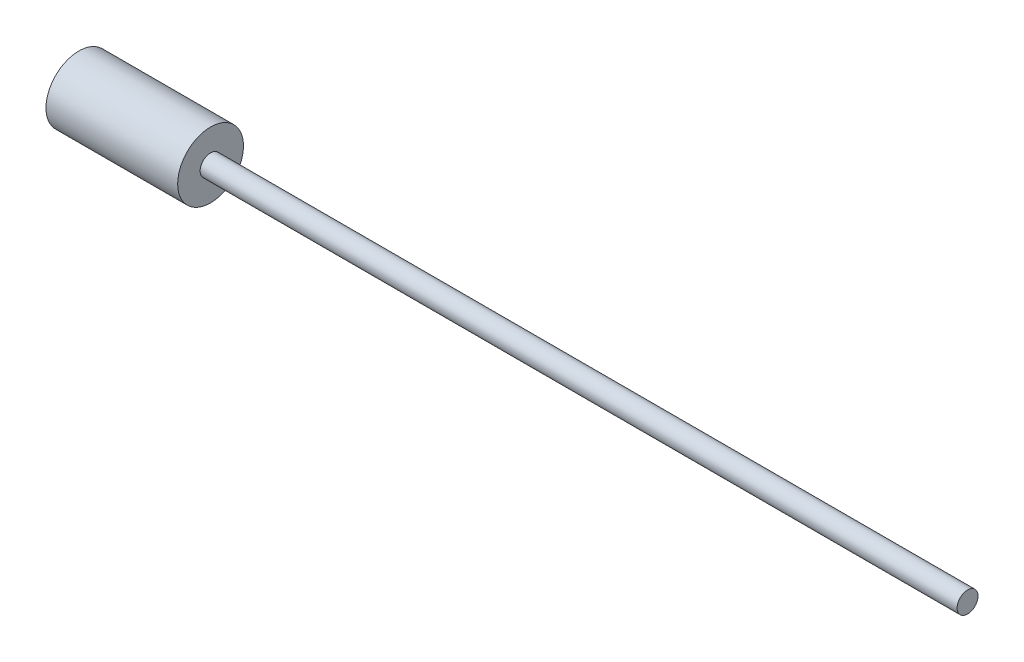
from build123d import *


with BuildPart() as part:
    # TC_Probe Sketch → TC_Probe (revolve)
    with BuildSketch(Plane.XY):
        Polygon((90, 0), (90, 1.5875), (-25, 1.5875), (-25, 5), (-45, 5), (-45, 0), align=None)
    revolve(axis=Axis((-1000, 0, 0), (1, 0, 0)))


solid = part.part
